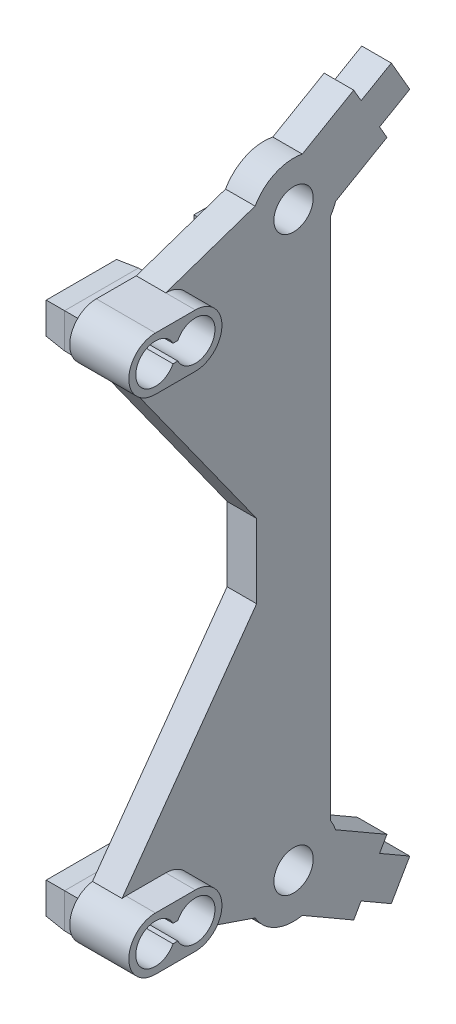
from build123d import *

# Parameters (mm, degrees)
SKETCH3_R                   = 3.81
DOWELSUPPORT_DEPTH          = 1.27
SKETCH5_W                   = 6.35
SKETCH5_H                   = 19.05
SLIDERDOWELSUPPORT_DEPTH    = 1.27
LATERALSUPPORT_DEPTH        = 1.27
SKETCH8_W                   = 6.35
SKETCH8_H                   = 3
TABSUPPORT_DEPTH            = 1.27
STRINGDOWELSUPPORT_START    = -1.27
STRINGDOWELSUPPORT_DEPTH    = 5.08
INTERSUPPORT_DEPTH          = 1.27
SKETCH10_W                  = 6.35
SKETCH10_H                  = 3
TABBASE_DEPTH               = 1.27
SKETCH12_W                  = 6.35
SKETCH12_H                  = 3
TABDRAFT_DEPTH              = 1.73
TABDRAFT_DRAFT              = 5
TABDRAFT_PROFILE_2_DEPTH    = 1.73
TABDRAFT_PROFILE_2_DRAFT    = 5
STRINGDOWELHOLES_DEPTH      = 36.898872819
STRINGDOWELHOLES_DEPTH_BACK = 1.524
SKETCH14_R                  = 1.690500048
PULLEYDOWELHOLE_DEPTH       = 2.54


with BuildPart() as part:
    # Sketch3 → DowelSupport (new, symmetric)
    with BuildSketch(Plane(origin=(0, 0, 0), x_dir=(0, 0, -1), z_dir=(1, 0, 0))):
        with Locations((0, 24.60625)):
            Circle(SKETCH3_R)
    extrude(amount=DOWELSUPPORT_DEPTH, both=True)

    # Sketch8 → TabSupport (add, symmetric)
    with BuildSketch(Plane(origin=(0, 0, 0), x_dir=(0, 0, -1), z_dir=(1, 0, 0))):
        with Locations((0, 21.59)):
            Rectangle(SKETCH8_W, SKETCH8_H)
        with Locations((-12.7, 21.59)):
            Rectangle(SKETCH8_W, SKETCH8_H)
    extrude(amount=TABSUPPORT_DEPTH, both=True)


with BuildPart() as body_2:
    # Sketch5 → SliderDowelSupport (new, symmetric)
    with BuildSketch(Plane(origin=(0, 0, 0), x_dir=(0, 0, -1), z_dir=(1, 0, 0))):
        Rectangle(SKETCH5_W, SKETCH5_H)
    extrude(amount=SLIDERDOWELSUPPORT_DEPTH, both=True)



with BuildPart() as body_3:
    # Sketch6 → LateralSupport (new, symmetric)
    with BuildSketch(Plane(origin=(0, 0, 0), x_dir=(0, 0, -1), z_dir=(1, 0, 0))):
        Polygon((7.392863577, 27.041434671), (5.805363577, 29.791065329), (8.403439788, 31.291065329), (9.990939788, 28.541434671), align=None)
    extrude(amount=LATERALSUPPORT_DEPTH, both=True)


with BuildPart() as tabsupport_piece_1:
    # of the separate pieces the step leaves, piece 1, a body of its own (tabsupport_pieces)
    add(part.part.solids().sort_by_distance((1.27, 22.500193258, 3.175))[0])


with BuildPart() as tabsupport_piece_2:
    # of the separate pieces the step leaves, piece 2, a body of its own (tabsupport_pieces)
    add(part.part.solids().sort_by_distance((-1.27, 20.09, 9.525))[0])

    # Sketch15 → StringDowelSupport (add)
    with BuildSketch(Plane(origin=(0, 0, 0), x_dir=(0, 0, -1), z_dir=(1, 0, 0)).offset(STRINGDOWELSUPPORT_START)):
        with BuildLine():
            Line((-14.4145, 23.876), (-10.9855, 23.876))
            ThreePointArc((-10.9855, 23.876), (-8.6995, 21.59), (-10.9855, 19.304))
            Line((-10.9855, 19.304), (-14.4145, 19.304))
            ThreePointArc((-14.4145, 19.304), (-16.7005, 21.59), (-14.4145, 23.876))
        make_face()
    extrude(amount=STRINGDOWELSUPPORT_DEPTH)


with BuildPart() as body_2_1:
    add(body_2.part)

    add(body_3.part)  # InterSupport merges body 3

    add(tabsupport_piece_1.part)  # InterSupport merges TabSupport piece 1

    add(tabsupport_piece_2.part)  # InterSupport merges TabSupport piece 2
    # Sketch7 → InterSupport (add, symmetric)
    with BuildSketch(Plane(origin=(0, 0, 0), x_dir=(0, 0, -1), z_dir=(1, 0, 0))):
        Polygon((-15.705016006, 20.665486783), (-3.175, 3.175), (-3.175, 9.525), (3.175, 9.525), (3.175, 20.09), (0.923046602, 21.901940251), (-0.923046602, 27.310559749), (-10.9855, 23.876), (-14.4145, 23.876), align=None)
        Polygon((5.170363577, 30.890917591), (8.027863577, 25.941582409), (1.42875, 22.131582409), (-1.42875, 27.080917591), align=None)
    extrude(amount=INTERSUPPORT_DEPTH, both=True)

    # Sketch10 → TabBase (add)
    with BuildSketch(Plane.ZY.offset(1.27)):
        with Locations((0, 21.59)):
            Rectangle(SKETCH10_W, SKETCH10_H)
        with Locations((12.7, 21.59)):
            Rectangle(SKETCH10_W, SKETCH10_H)
    extrude(amount=TABBASE_DEPTH)


with BuildPart() as tabdraft_tool:
    # Sketch12 → TabDraft (with draft: the straight prism first)
    with BuildSketch(Plane.ZY.offset(2.54)):
        with Locations((0, 21.59)):
            Rectangle(SKETCH12_W, SKETCH12_H)
    extrude(amount=TABDRAFT_DEPTH)
    # TabDraft: the draft: its side faces are tilted about the plane it starts from
    tabdraft_sides = [tabdraft_tool.faces().sort_by_distance(p)[0] for p in [
        (-3.405, 21.59, 3.175),
        (-3.405, 23.09, 0),
        (-3.405, 21.59, -3.175),
        (-3.405, 20.09, 0),
    ]]
    draft(tabdraft_sides, Plane.ZY.offset(2.54), TABDRAFT_DRAFT)


with BuildPart() as body_2_2:
    add(body_2_1.part)

    # TabDraft: add tabdraft_tool
    add(tabdraft_tool.part)


with BuildPart() as tabdraft_profile_2_tool:
    # Sketch12 → TabDraft profile 2 (with draft: the straight prism first)
    with BuildSketch(Plane.ZY.offset(2.54)):
        with Locations((12.7, 21.59)):
            Rectangle(SKETCH12_W, SKETCH12_H)
    extrude(amount=TABDRAFT_PROFILE_2_DEPTH)
    # TabDraft profile 2: the draft: its side faces are tilted about the plane it starts from
    tabdraft_profile_2_sides = [tabdraft_profile_2_tool.faces().sort_by_distance(p)[0] for p in [
        (-3.405, 21.59, 9.525),
        (-3.405, 20.09, 12.7),
        (-3.405, 21.59, 15.875),
        (-3.405, 23.09, 12.7),
    ]]
    draft(tabdraft_profile_2_sides, Plane.ZY.offset(2.54), TABDRAFT_PROFILE_2_DRAFT)


with BuildPart() as body_2_3:
    add(body_2_2.part)

    # TabDraft profile 2: add tabdraft_profile_2_tool
    add(tabdraft_profile_2_tool.part)

    # Sketch16 → StringDowelHoles (cut, two sides: drawn at the far end of the back side and taken through both)
    with BuildSketch(Plane(origin=(1.27, 0, 0), x_dir=(0, 0, -1), z_dir=(1, 0, 0)).offset(-STRINGDOWELHOLES_DEPTH_BACK)):
        with BuildLine():
            Line((-12.905478326, 20.828), (-12.494521674, 20.828))
            ThreePointArc((-12.494521674, 20.828), (-9.294999952, 21.59), (-12.494521674, 22.352))
            Line((-12.494521674, 22.352), (-12.905478326, 22.352))
            ThreePointArc((-12.905478326, 22.352), (-16.105000048, 21.59), (-12.905478326, 20.828))
        make_face()
    extrude(amount=STRINGDOWELHOLES_DEPTH + STRINGDOWELHOLES_DEPTH_BACK, mode=Mode.SUBTRACT)

    # Sketch14 → PulleyDowelHole (cut)
    with BuildSketch(Plane(origin=(1.27, 0, 0), x_dir=(0, 0, -1), z_dir=(1, 0, 0))):
        with Locations((0, 24.60625)):
            Circle(SKETCH14_R)
    extrude(amount=-PULLEYDOWELHOLE_DEPTH, mode=Mode.SUBTRACT)

    # Mirror1: body 2 across plane


with BuildPart() as body_2_4:
    add(body_2_3.part)
    add(body_2_3.part.mirror(Plane.ZX))


solid = body_2_4.part
